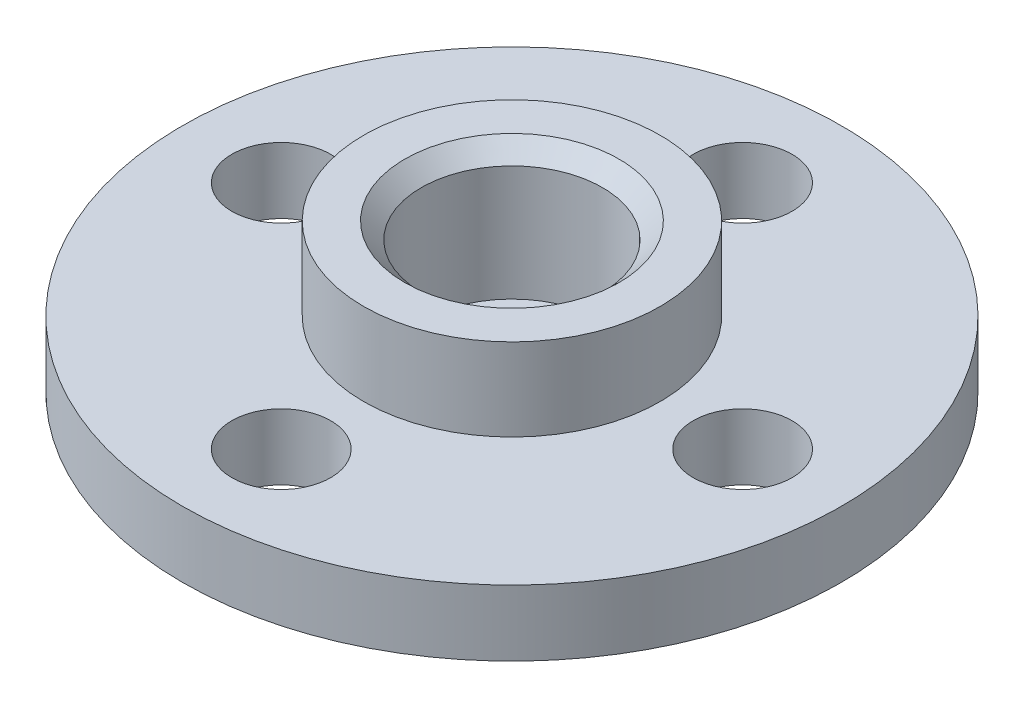
from build123d import *

# Parameters (mm, degrees)
SKETCH_1_R          = 10
EXTRUDE_1_DEPTH     = 2
SKETCH_2_R          = 1.5
CUT_EXTRUDE_1_DEPTH = 2
SKETCH_3_R          = 4.5
EXTRUDE_2_DEPTH     = 2.5
SKETCH_4_R          = 2.75
CUT_EXTRUDE_2_DEPTH = 4
SKETCH_5_R          = 1.5
CUT_EXTRUDE_3_DEPTH = 4
CHAMFER_1_SIZE      = 0.5


with BuildPart() as part:
    # 草图1 → 凸台-拉伸1 (new body)
    with BuildSketch(Plane(origin=(0, 0, 0), x_dir=(1, 0, 0), z_dir=(0, 1, 0))):
        with Locations(Location((0, 0, 0), (0, 0, 270))):
            Circle(SKETCH_1_R)
    extrude(amount=EXTRUDE_1_DEPTH)

    # 草图2 → 切除-拉伸1 (cut)
    with BuildSketch(Plane(origin=(0, 2, 0), x_dir=(1, 0, 0), z_dir=(0, 1, 0))):
        with Locations(Location((-7, 0, 0), (0, 0, 270))):
            Circle(SKETCH_2_R)
        with Locations(Location((0, 7, 0), (0, 0, 270))):
            Circle(SKETCH_2_R)
        with Locations(Location((7, 0, 0), (0, 0, 270))):
            Circle(SKETCH_2_R)
        with Locations(Location((0, -7, 0), (0, 0, 270))):
            Circle(SKETCH_2_R)
    extrude(amount=-CUT_EXTRUDE_1_DEPTH, mode=Mode.SUBTRACT)

    # 草图3 → 凸台-拉伸2 (add)
    with BuildSketch(Plane(origin=(0, 2, 0), x_dir=(1, 0, 0), z_dir=(0, 1, 0))):
        with Locations(Location((0, 0, 0), (0, 0, 270))):
            Circle(SKETCH_3_R)
    extrude(amount=EXTRUDE_2_DEPTH)

    # 草图4 → 切除-拉伸2 (cut)
    with BuildSketch(Plane(origin=(0, 4.5, 0), x_dir=(1, 0, 0), z_dir=(0, 1, 0))):
        with Locations(Location((0, 0, 0), (0, 0, 270))):
            Circle(SKETCH_4_R)
    extrude(amount=-CUT_EXTRUDE_2_DEPTH, mode=Mode.SUBTRACT)

    # 草图5 → 切除-拉伸3 (cut)
    with BuildSketch(Plane(origin=(0, 0.5, 0), x_dir=(1, 0, 0), z_dir=(0, 1, 0))):
        with Locations(Location((0, 0, 0), (0, 0, 270))):
            Circle(SKETCH_5_R)
    extrude(amount=-CUT_EXTRUDE_3_DEPTH, mode=Mode.SUBTRACT)

    # 倒角1
    chamfer_1_edges = [part.edges().sort_by_distance(p)[0] for p in [
        (0, 4.5, -2.75),
    ]]
    chamfer(chamfer_1_edges, length=CHAMFER_1_SIZE)


solid = part.part
